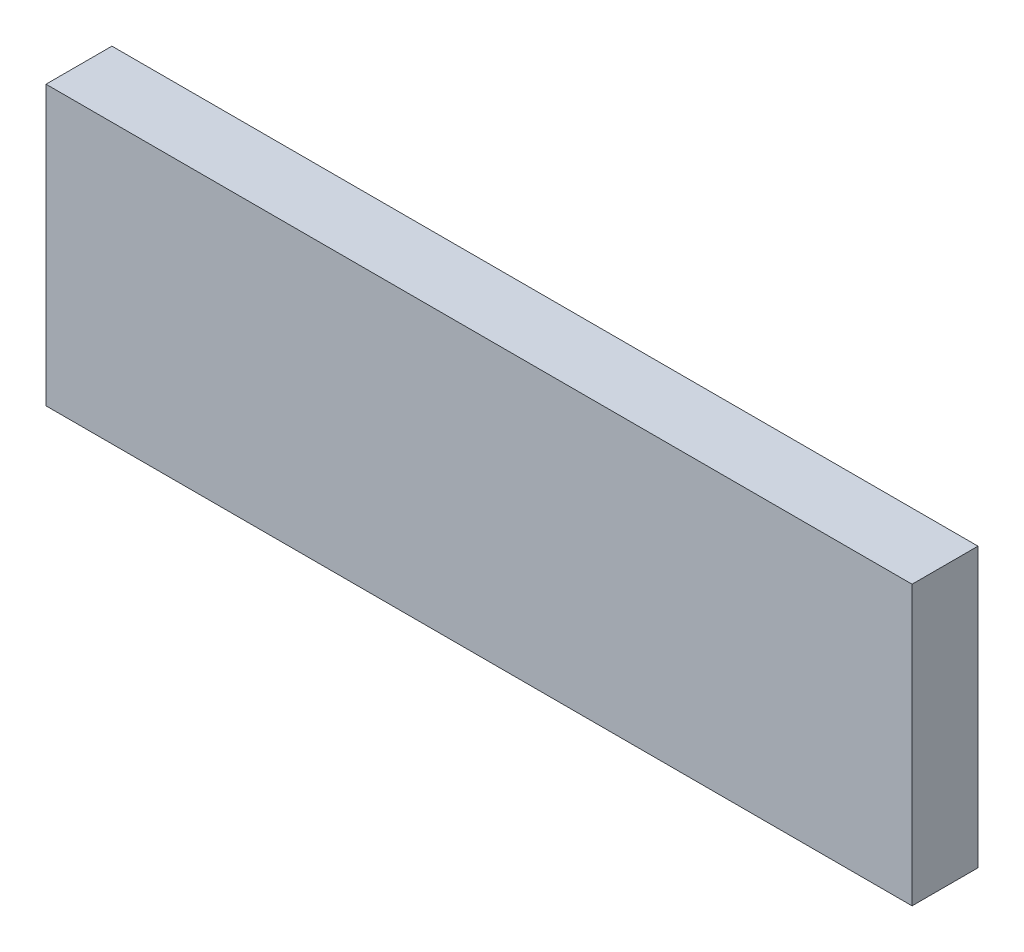
from build123d import *

# Parameters (mm, degrees)
SKETCH1_W           = 26.27
SKETCH1_H           = 8.45
BOSS_EXTRUDE1_DEPTH = 2


with BuildPart() as part:
    # Sketch1 → Boss-Extrude1 (new body)
    with BuildSketch(Plane.XY):
        Rectangle(SKETCH1_W, SKETCH1_H)
    extrude(amount=BOSS_EXTRUDE1_DEPTH)


solid = part.part
